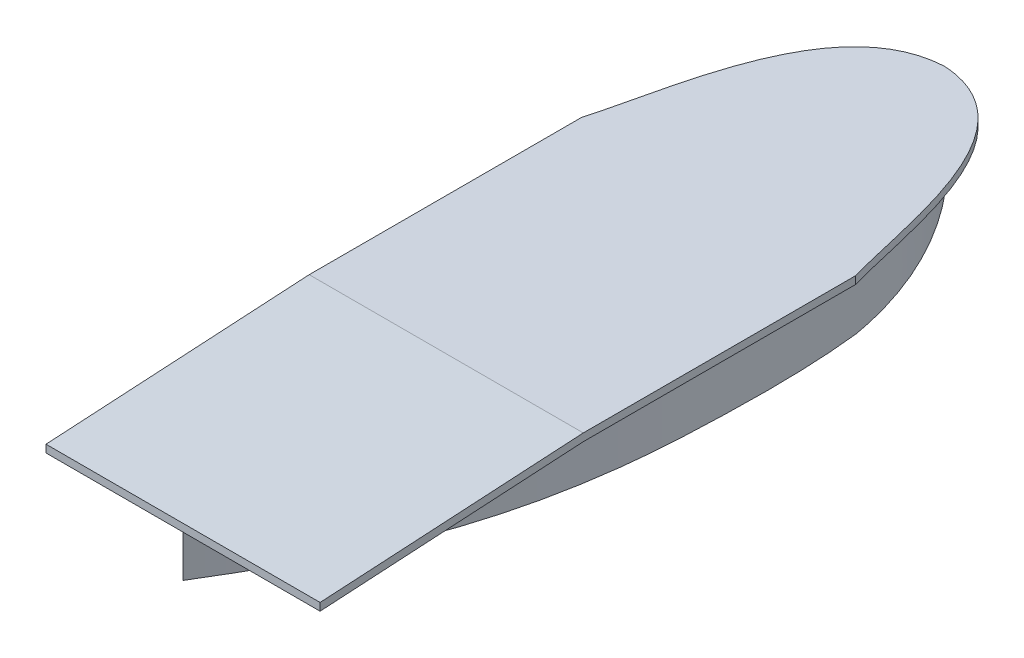
from build123d import *

# Parameters (mm, degrees)
BOSS_EXTRUDE1_DEPTH      = 750
SKETCH2_W                = 6975.913237254
SKETCH2_H                = 2573.531571043
CUT_EXTRUDE1_DEPTH       = 2867
BOSS_EXTRUDE2_DEPTH      = 2921
BOSS_EXTRUDE2_DEPTH_BACK = 1210
SKETCH5_W                = 6698.42061374
SKETCH5_H                = 6324.334564403
CUT_EXTRUDE3_DEPTH       = 3100
FILLET2_R                = 10000


with BuildPart() as part:
    # Sketch1 → Boss-Extrude1 (new body)
    with BuildSketch(Plane(origin=(0, 0, 0), x_dir=(1, 0, 0), z_dir=(0, 1, 0))):
        with BuildLine():
            add(Edge.make_bspline(
                [(457.2, 5000), (728.915452222, 4811.349464448), (923.139708936, 4099.368223749), (934.558203904, 2393.667926906), (728.421258801, 982.746821971), (457.2, 0)],
                knots=[0, 0, 0, 0, 0.183022235, 0.40493596, 1, 1, 1, 1], degree=3))
            add(Edge.make_bspline(
                [(457.2, 5000), (185.484547778, 4811.349464448), (-8.739708936, 4099.368223749), (-20.158203904, 2393.667926906), (185.978741199, 982.746821971), (457.2, 0)],
                knots=[0, 0, 0, 0, 0.183022235, 0.40493596, 1, 1, 1, 1], degree=3))
        make_face()
    extrude(amount=BOSS_EXTRUDE1_DEPTH)

    # Sketch2 → Cut-Extrude1 (cut)
    with BuildSketch(Plane(origin=(0, 0, 0), x_dir=(0, 0, -1), z_dir=(1, 0, 0))):
        with Locations((2719.433095854, 156.320643039)):
            Rectangle(SKETCH2_W, SKETCH2_H)
        with BuildLine():
            Line((1728.349661048, 750), (0, 650))
            Line((0, 650), (0, 375))
            Line((0, 375), (1805.00804827, 0))
            Line((1805.00804827, 0), (3989.772084114, 0))
            add(Edge.make_bspline(
                [(5000, 375), (4563.550025153, 43.584239046), (3989.772084114, 0)],
                knots=[0, 0, 0, 1, 1, 1], degree=2))
            Line((5000, 375), (5000, 750))
            Line((5000, 750), (3617.237996244, 750))
            Line((3617.237996244, 750), (1728.349661048, 750))
        make_face(mode=Mode.SUBTRACT)
    extrude(amount=CUT_EXTRUDE1_DEPTH, mode=Mode.SUBTRACT)

    # Sketch3 → Boss-Extrude2 (add, two sides: drawn at the far end of the back side and taken through both)
    with BuildSketch(Plane(origin=(0, 0, 0), x_dir=(0, 0, -1), z_dir=(1, 0, 0)).offset(-BOSS_EXTRUDE2_DEPTH_BACK)):
        Polygon((3617.237996244, 800), (1728.349661048, 800), (0, 700), (0, 650), (1728.349661048, 750), (3617.237996244, 750), (5569.161604156, 750), (5569.161604156, 800), align=None)
    extrude(amount=BOSS_EXTRUDE2_DEPTH + BOSS_EXTRUDE2_DEPTH_BACK)

    # Sketch5 → Cut-Extrude3 (cut)
    with BuildSketch(Plane(origin=(0, 0, 0), x_dir=(1, 0, 0), z_dir=(0, 1, 0))):
        with Locations((880.24294103, 2985.272815756)):
            Rectangle(SKETCH5_W, SKETCH5_H)
        with BuildLine():
            Line((1357.2, 0), (-442.8, 0))
            Line((-442.8, 0), (-442.8, 3516.972726751))
            add(Edge.make_bspline(
                [(457.2, 5000), (-208.486103142, 4963.203394616), (-308.020397479, 3985.874175644), (-442.8, 3516.972726751)],
                knots=[0, 0, 0, 0, 1, 1, 1, 1], degree=3))
            add(Edge.make_bspline(
                [(457.2, 5000), (1122.886103142, 4963.203394616), (1222.420397479, 3985.874175644), (1357.2, 3516.972726751)],
                knots=[0, 0, 0, 0, 1, 1, 1, 1], degree=3))
            Line((1357.2, 3516.972726751), (1357.2, 0))
        make_face(mode=Mode.SUBTRACT)
    extrude(amount=CUT_EXTRUDE3_DEPTH, mode=Mode.SUBTRACT)

    # Fillet2
    fillet2_edges = [part.edges().sort_by_distance(p)[0] for p in [
        (457.2, 0, -1805.00804827),
    ]]
    fillet(fillet2_edges, radius=FILLET2_R)


solid = part.part
